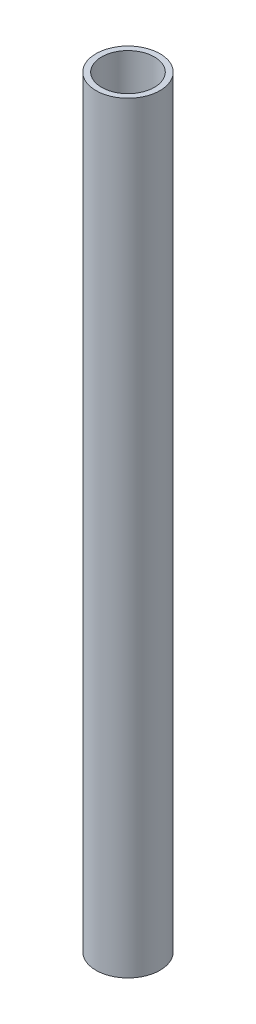
from build123d import *

# Parameters (mm, degrees)
SKETCH_1_R      = 12.6
EXTRUDE_1_DEPTH = 300
SHELL_1_T       = -2.2


with BuildPart() as part:
    # 스케치1 → 보스-돌출1 (new body)
    with BuildSketch(Plane(origin=(0, 0, 0), x_dir=(1, 0, 0), z_dir=(0, 1, 0))):
        with Locations(Location((0, 0, 0), (0, 0, 270))):
            Circle(SKETCH_1_R)
    extrude(amount=EXTRUDE_1_DEPTH)

    # 쉘1
    shell_1_openings = [part.faces().sort_by_distance(p)[0] for p in [
        (0, 300, 0),
        (0, 0, 0),
    ]]
    offset(amount=SHELL_1_T, openings=shell_1_openings, kind=Kind.INTERSECTION)


solid = part.part
